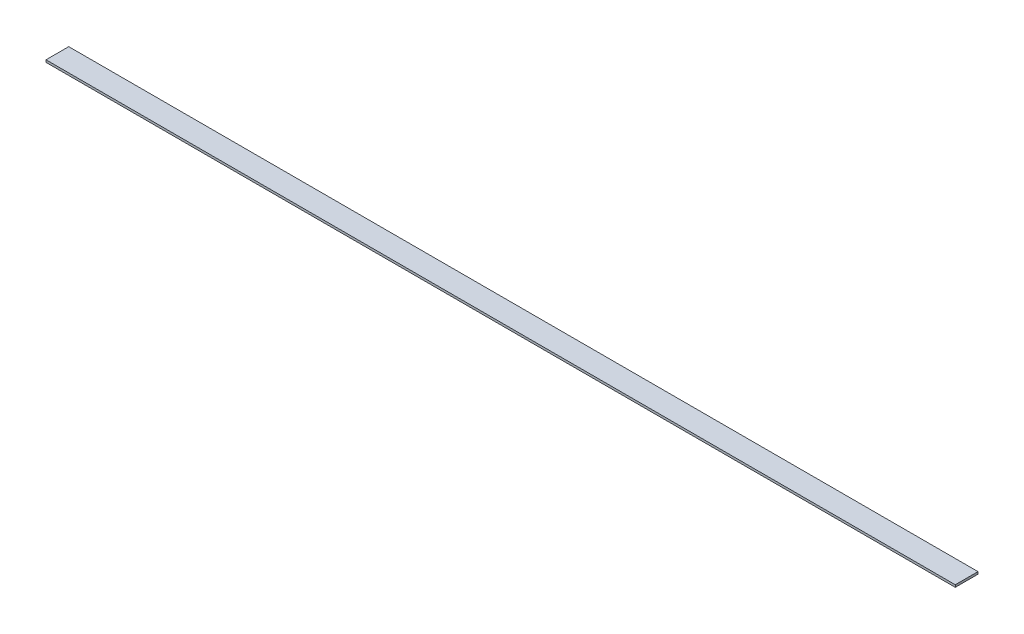
from build123d import *

# Parameters (mm, degrees)
SKETCH1_W           = 101.6
SKETCH1_H           = 2.54
BOSS_EXTRUDE1_DEPTH = 0.254


with BuildPart() as part:
    # Sketch1 → Boss-Extrude1 (new body)
    with BuildSketch(Plane(origin=(0, 0, 0), x_dir=(1, 0, 0), z_dir=(0, 1, 0))):
        with Locations((-68.729411765, 7.25413273)):
            Rectangle(SKETCH1_W, SKETCH1_H)
    extrude(amount=BOSS_EXTRUDE1_DEPTH)


solid = part.part
